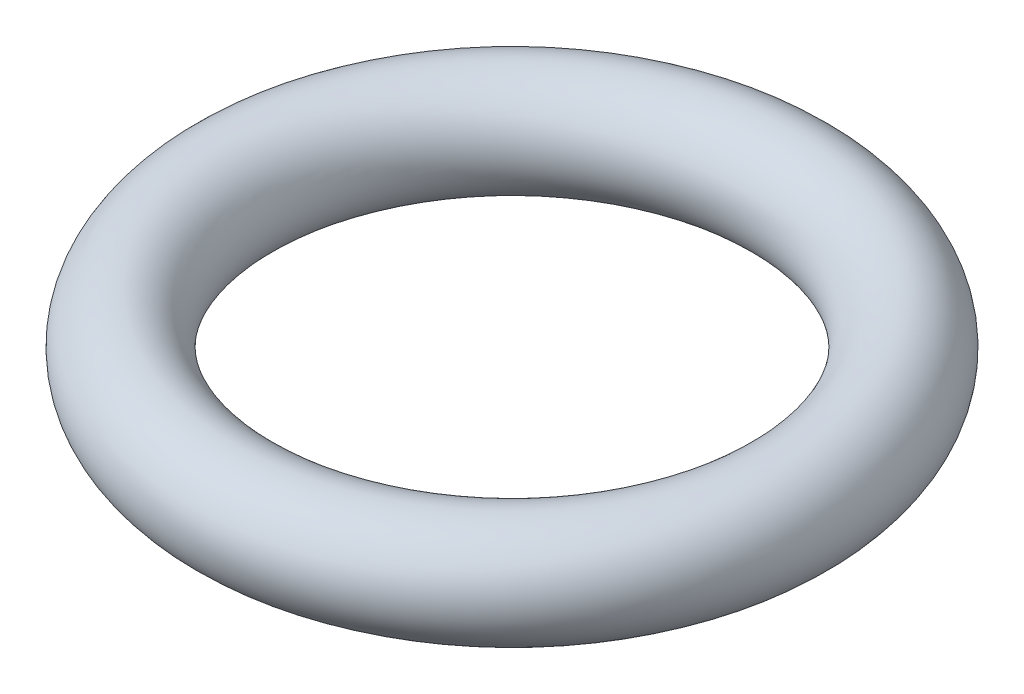
from build123d import *

# Parameters (mm, degrees)
SKETCH1_R = 1


with BuildPart() as part:
    # Sketch1 → Revolve1 (revolve)
    with BuildSketch(Plane.XY, mode=Mode.PRIVATE) as revolve1_sk:
        with Locations((5.25, 0)):
            Circle(SKETCH1_R)
    revolve(revolve1_sk.sketch.rotate(Axis((0, 2, 0), (0, -1, 0)), 90), axis=Axis((0, 2, 0), (0, -1, 0)))


solid = part.part
